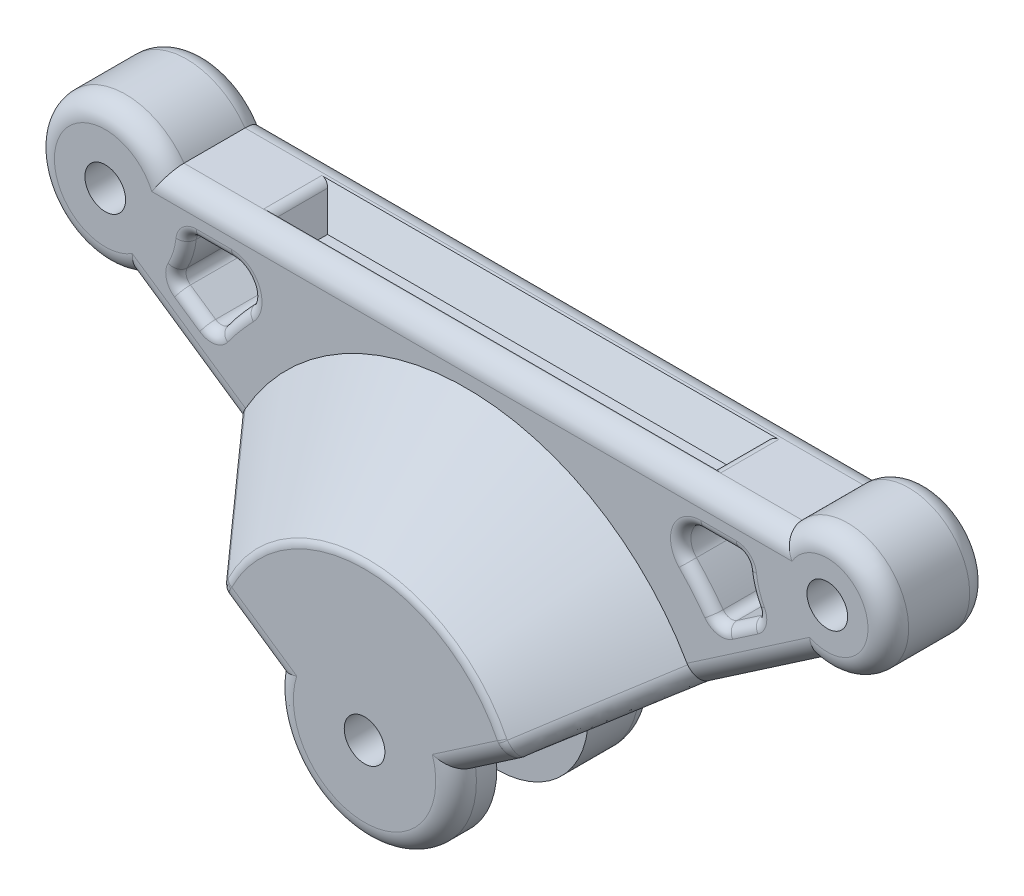
from build123d import *

# Parameters (mm, degrees)
EXTRUDE_1_DEPTH          = 10
CUT_EXTRUDE_START        = -3
CUT_EXTRUDE_1_DEPTH      = 3
EXTRUDE_2_DEPTH          = 6
EXTRUDE_3_DEPTH          = 4
CUT_EXTRUDE_2_DEPTH      = 57.424271335
DRAFT_1_ANGLE            = 45
SKETCH_7_W               = 43.789876442
SKETCH_7_H               = 5.678360146
CUT_EXTRUDE_3_DEPTH      = 3
CUT_EXTRUDE_3_DRAFT      = -30
CUT_EXTRUDE_4_DEPTH      = 57.424271335
CUT_EXTRUDE_4_DEPTH_BACK = 57.424271335
SKETCH_8_R               = 2
FILLET_1_R               = 2
FILLET_2_R               = 1
FILLET_3_R               = 1


with BuildPart() as part:
    # 草图2 → 凸台-拉伸1 (new body)
    with BuildSketch(Plane.XY):
        with BuildLine():
            Line((8.913182198, 1.247069805), (34.065019955, 18.438295022))
            ThreePointArc((34.065019955, 18.438295022), (41.232404828, 26.036044387), (31.027864045, 28.264171117))
            Line((31.027864045, 28.264171117), (-29.755437353, 28.264171117))
            ThreePointArc((-29.755437353, 28.264171117), (-42.187805633, 26.331356598), (-33.014528152, 17.720286209))
            Line((-33.014528152, 17.720286209), (-8.913182198, 1.247069805))
            ThreePointArc((-8.913182198, 1.247069805), (0, -9), (8.913182198, 1.247069805))
        make_face()
    extrude(amount=EXTRUDE_1_DEPTH)

    # 草图3 → 切除-拉伸1 (cut)
    with BuildSketch(Plane.XY.offset(10).offset(CUT_EXTRUDE_START)):
        with BuildLine():
            Line((-8.913182198, 1.247069805), (-10.716824108, 2.479855042))
            ThreePointArc((-10.716824108, 2.479855042), (0, 11), (10.716824108, 2.479855042))
            Line((10.716824108, 2.479855042), (8.913182198, 1.247069805))
            ThreePointArc((8.913182198, 1.247069805), (0, -9), (-8.913182198, 1.247069805))
        make_face()
    extrude(amount=CUT_EXTRUDE_1_DEPTH, mode=Mode.SUBTRACT)

    # 草图4 → 凸台-拉伸2 (add)
    with BuildSketch(Plane.XY.offset(10)):
        with BuildLine():
            Line((10.716824108, 2.479855042), (22.630768249, 10.623009389))
            ThreePointArc((22.630768249, 10.623009389), (0, 25), (-22.630768249, 10.623009389))
            Line((-22.630768249, 10.623009389), (-10.716824108, 2.479855042))
            ThreePointArc((-10.716824108, 2.479855042), (0, 11), (10.716824108, 2.479855042))
        make_face()
    extrude(amount=EXTRUDE_2_DEPTH)

    # 草图5 → 凸台-拉伸3 (add)
    with BuildSketch(Plane.XY.offset(16)):
        with BuildLine():
            Line((-10.716824108, 2.479855042), (-8.913182198, 1.247069805))
            ThreePointArc((-8.913182198, 1.247069805), (0, -9), (8.913182198, 1.247069805))
            Line((8.913182198, 1.247069805), (10.716824108, 2.479855042))
            Line((10.716824108, 2.479855042), (22.630768249, 10.623009389))
            ThreePointArc((22.630768249, 10.623009389), (0, 25), (-22.630768249, 10.623009389))
            Line((-22.630768249, 10.623009389), (-10.716824108, 2.479855042))
        make_face()
    extrude(amount=EXTRUDE_3_DEPTH)

    # 草图6 → 切除-拉伸2 (cut, through all)
    with BuildSketch(Plane(origin=(0, 0, 0), x_dir=(-1, 0, 0), z_dir=(0, 0, -1))):
        with BuildLine():
            Line((-28.893182198, 19.74842583), (-24.825404014, 16.96810848))
            ThreePointArc((-24.825404014, 16.96810848), (-23.316294924, 18.988705205), (-21.643182198, 20.875743937))
            ThreePointArc((-21.643182198, 20.875743937), (-21.241952212, 23.046202331), (-23.082720307, 24.264171117))
            Line((-23.082720307, 24.264171117), (-27.496820931, 24.264171117))
            ThreePointArc((-27.496820931, 24.264171117), (-27.85387942, 21.900816495), (-28.893182198, 19.74842583))
        make_face()
        with BuildLine():
            Line((23.084803996, 24.264171117), (27.498904619, 24.264171117))
            ThreePointArc((27.498904619, 24.264171117), (27.855963109, 21.900816495), (28.895265887, 19.74842583))
            Line((28.895265887, 19.74842583), (24.827487702, 16.96810848))
            ThreePointArc((24.827487702, 16.96810848), (23.318378613, 18.988705205), (21.645265887, 20.875743937))
            ThreePointArc((21.645265887, 20.875743937), (21.244035901, 23.046202331), (23.084803996, 24.264171117))
        make_face()
    extrude(amount=-CUT_EXTRUDE_2_DEPTH, mode=Mode.SUBTRACT)

    # 拔模1
    draft_1_faces = [part.faces().sort_by_distance(p)[0] for p in [
        (0, 25, 15),
    ]]
    draft(draft_1_faces, Plane.XY.offset(10), DRAFT_1_ANGLE)


with BuildPart() as cut_extrude_3_tool:
    # 草图7 → 切除-拉伸3 (with draft: the straight prism first)
    with BuildSketch(Plane(origin=(0, 28.264171117, 0), x_dir=(1, 0, 0), z_dir=(0, 1, 0))):
        with Locations((0.53054003, -5.11548542)):
            Rectangle(SKETCH_7_W, SKETCH_7_H)
    extrude(amount=-CUT_EXTRUDE_3_DEPTH)
    # 切除-拉伸3: the draft: its side faces are tilted about the plane it starts from
    cut_extrude_3_sides = [cut_extrude_3_tool.faces().sort_by_distance(p)[0] for p in [
        (-21.364398191, 26.764171117, 5.11548542),
        (0.53054003, 26.764171117, 7.954665493),
        (22.425478251, 26.764171117, 5.11548542),
        (0.53054003, 26.764171117, 2.276305347),
    ]]
    draft(cut_extrude_3_sides, Plane(origin=(0, 28.264171117, 0), x_dir=(1, 0, 0), z_dir=(0, 1, 0)), CUT_EXTRUDE_3_DRAFT)


with BuildPart() as part_1:
    add(part.part)

    # 切除-拉伸3: cut by cut_extrude_3_tool
    add(cut_extrude_3_tool.part, mode=Mode.SUBTRACT)

    # 草图8 → 切除-拉伸4 (cut, two sides: drawn at the far end of the back side and taken through both)
    with BuildSketch(Plane(origin=(0, 0, 0), x_dir=(-1, 0, 0), z_dir=(0, 0, -1)).offset(-CUT_EXTRUDE_4_DEPTH_BACK)):
        Circle(SKETCH_8_R)
        with Locations(Location((35.5, 24.264171117, 0), (0, 0, 180))):
            Circle(SKETCH_8_R)
        with Locations(Location((-35.5, 24.264171117, 0), (0, 0, 180))):
            Circle(SKETCH_8_R)
    extrude(amount=CUT_EXTRUDE_4_DEPTH + CUT_EXTRUDE_4_DEPTH_BACK, mode=Mode.SUBTRACT)

    # 圆角1
    fillet_1_edges = [part_1.edges().sort_by_distance(p)[0] for p in [
        (41.232404828, 26.036044387, 10),
        (0.636213346, 28.264171117, 10),
        (-42.187805633, 26.331356598, 10),
        (-27.8226482, 14.171647799, 10),
        (28.347894102, 14.530652206, 10),
        (18.423123109, 7.747093285, 15.014282114),
        (-18.423123109, 7.747093285, 15.014282114),
        (11.552803087, 3.051244816, 20),
        (-11.552803087, 3.051244816, 20),
        (0, -9, 20),
        (-20.963855175, 9.483678007, 0),
        (-42.187805633, 26.331356598, 0),
        (0.636213346, 28.264171117, 0),
        (41.232404828, 26.036044387, 0),
        (21.489101077, 9.842682413, 0),
        (0, -9, 0),
    ]]
    fillet(fillet_1_edges, radius=FILLET_1_R)

    # 圆角2
    fillet_2_edges = [part_1.edges().sort_by_distance(p)[0] for p in [
        (14.008373181, 5.324572753, 19.312807766),
        (13.45077671, 6.645127039, 19.997296657),
        (-14.008373181, 5.324572753, 19.312807766),
        (-13.45077671, 6.645127039, 19.997296657),
        (0, 15, 20),
    ]]
    fillet(fillet_2_edges, radius=FILLET_2_R)

    # 圆角3
    fillet_3_edges = [part_1.edges().sort_by_distance(p)[0] for p in [
        (-21.364398191, 28.264171117, 5.11548542),
        (22.425478251, 28.264171117, 5.11548542),
        (27.85387942, 21.900816495, 10),
        (25.289770619, 24.264171117, 10),
        (21.241952212, 23.046202331, 10),
        (23.316294924, 18.988705205, 10),
        (26.859293106, 18.358267155, 10),
        (28.893182198, 19.74842583, 5),
        (27.496820931, 24.264171117, 5),
        (24.825404014, 16.96810848, 5),
        (27.85387942, 21.900816495, 0),
        (26.859293106, 18.358267155, 0),
        (23.316294924, 18.988705205, 0),
        (21.241952212, 23.046202331, 0),
        (25.289770619, 24.264171117, 0),
        (-27.855963109, 21.900816495, 10),
        (-26.861376795, 18.358267155, 10),
        (-23.318378613, 18.988705205, 10),
        (-21.244035901, 23.046202331, 10),
        (-25.291854307, 24.264171117, 10),
        (-27.498904619, 24.264171117, 5),
        (-28.895265887, 19.74842583, 5),
        (-24.827487702, 16.96810848, 5),
        (-27.855963109, 21.900816495, 0),
        (-25.291854307, 24.264171117, 0),
        (-21.244035901, 23.046202331, 0),
        (-23.318378613, 18.988705205, 0),
        (-26.861376795, 18.358267155, 0),
    ]]
    fillet(fillet_3_edges, radius=FILLET_3_R)


solid = part_1.part
